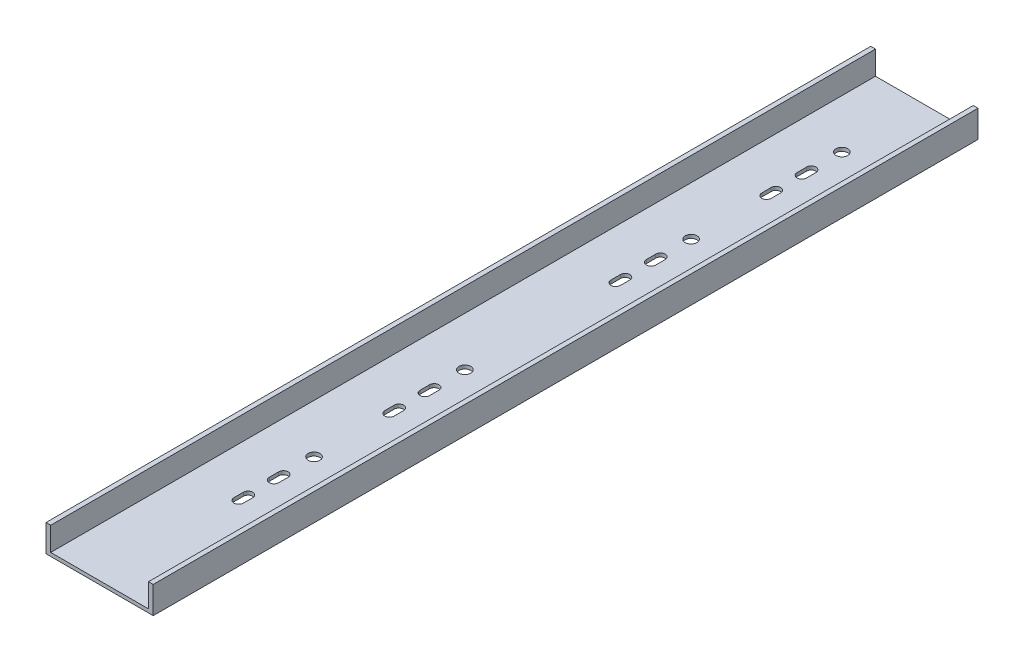
from build123d import *

# Parameters (mm, degrees)
EXTRUDE_1_DEPTH                  = 350
SKETCH_2_R                       = 2.5
CUT_EXTRUDE_1_DEPTH              = 350
PATTERN_LINEAR_1_COUNT           = 2
PATTERN_LINEAR_1_PITCH           = 64
PATTERN_LINEAR_2_COUNT           = 2
PATTERN_LINEAR_2_PITCH           = 160
PATTERN_LINEAR_3_COPY_1_SKETCH_R = 2.5
PATTERN_LINEAR_3_COPY_1_DEPTH    = 350
PATTERN_LINEAR_3_COPY_2_SKETCH_R = 2.5
PATTERN_LINEAR_3_COPY_2_DEPTH    = 350


with BuildPart() as part:
    # 草图1 → 凸台-拉伸1 (new body)
    with BuildSketch(Plane.XY):
        Polygon((-22.75, 0), (22.75, 0), (22.75, 11.5), (20.75, 11.5), (20.75, 1.5), (-20.75, 1.5), (-20.75, 11.5), (-22.75, 11.5), align=None)
    extrude(amount=EXTRUDE_1_DEPTH)

    # 草图2 → 切除-拉伸1 (cut)
    with BuildSketch(Plane.XZ):
        with Locations(Location((0, 35, 0), (0, 0, 270))):
            Circle(SKETCH_2_R)
        with BuildLine():
            Line((2, 52), (2, 48))
            ThreePointArc((2, 48), (0, 46), (-2, 48))
            Line((-2, 48), (-2, 52))
            ThreePointArc((-2, 52), (0, 54), (2, 52))
        make_face()
        with BuildLine():
            Line((-2, 67), (-2, 63))
            ThreePointArc((-2, 63), (0, 61), (2, 63))
            Line((2, 63), (2, 67))
            ThreePointArc((2, 67), (0, 69), (-2, 67))
        make_face()
    cut_extrude_1 = extrude(amount=-CUT_EXTRUDE_1_DEPTH, mode=Mode.SUBTRACT)

    # 阵列(线性)1: 切除-拉伸1 ×2
    with Locations(*[(0, 0, i * PATTERN_LINEAR_1_PITCH) for i in range(1, PATTERN_LINEAR_1_COUNT)]):
        add(cut_extrude_1, mode=Mode.SUBTRACT)

    # 阵列(线性)2: 切除-拉伸1 ×2
    with Locations(*[(0, 0, i * PATTERN_LINEAR_2_PITCH) for i in range(1, PATTERN_LINEAR_2_COUNT)]):
        add(cut_extrude_1, mode=Mode.SUBTRACT)

    # 阵列(线性)3 copy 1 sketch → 阵列(线性)3 copy 1 (cut)
    with BuildSketch(Plane(origin=(0, 0, 224), x_dir=(1, 0, 0), z_dir=(0, -1, 0))):
        with Locations(Location((0, 35, 0), (0, 0, 270))):
            Circle(PATTERN_LINEAR_3_COPY_1_SKETCH_R)
        with BuildLine():
            Line((2, 52), (2, 48))
            ThreePointArc((2, 48), (0, 46), (-2, 48))
            Line((-2, 48), (-2, 52))
            ThreePointArc((-2, 52), (0, 54), (2, 52))
        make_face()
        with BuildLine():
            Line((-2, 67), (-2, 63))
            ThreePointArc((-2, 63), (0, 61), (2, 63))
            Line((2, 63), (2, 67))
            ThreePointArc((2, 67), (0, 69), (-2, 67))
        make_face()
    extrude(amount=-PATTERN_LINEAR_3_COPY_1_DEPTH, mode=Mode.SUBTRACT)

    # 阵列(线性)3 copy 2 sketch → 阵列(线性)3 copy 2 (cut)
    with BuildSketch(Plane(origin=(0, 0, 160), x_dir=(1, 0, 0), z_dir=(0, -1, 0))):
        with Locations(Location((0, 35, 0), (0, 0, 270))):
            Circle(PATTERN_LINEAR_3_COPY_2_SKETCH_R)
        with BuildLine():
            Line((2, 52), (2, 48))
            ThreePointArc((2, 48), (0, 46), (-2, 48))
            Line((-2, 48), (-2, 52))
            ThreePointArc((-2, 52), (0, 54), (2, 52))
        make_face()
        with BuildLine():
            Line((-2, 67), (-2, 63))
            ThreePointArc((-2, 63), (0, 61), (2, 63))
            Line((2, 63), (2, 67))
            ThreePointArc((2, 67), (0, 69), (-2, 67))
        make_face()
    extrude(amount=-PATTERN_LINEAR_3_COPY_2_DEPTH, mode=Mode.SUBTRACT)


solid = part.part
